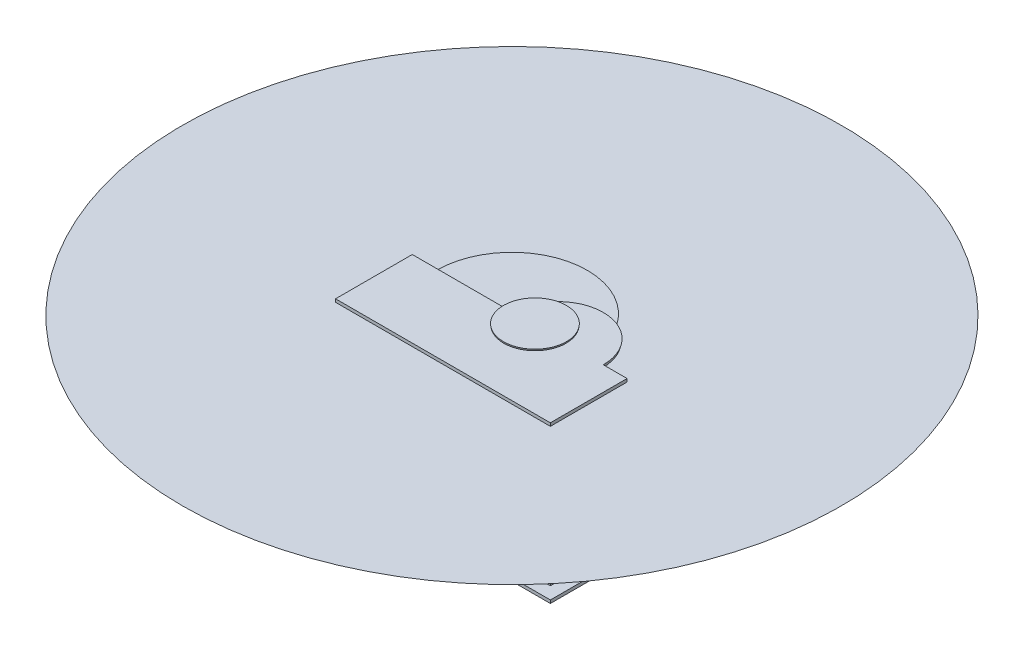
from build123d import *

# Parameters (mm, degrees)
SKETCH1_R           = 0.25
BOSS_EXTRUDE1_DEPTH = 10.1
BOSS_EXTRUDE1_DRAFT = -15
SKETCH2_R           = 0.25
BOSS_EXTRUDE2_DEPTH = 10
BOSS_EXTRUDE2_DRAFT = 25
SKETCH3_W           = 14
SKETCH3_H           = 0.2
EXTRUDE_THIN1_DEPTH = 5
SKETCH4_W           = 2.1
SKETCH4_H           = 2.1
BOSS_EXTRUDE3_DEPTH = 0.7
SKETCH5_W           = 2
SKETCH5_H           = 3.8
BOSS_EXTRUDE4_DEPTH = 2.1
SKETCH7_R           = 0.25
BOSS_EXTRUDE5_DEPTH = 9.9
BOSS_EXTRUDE5_DRAFT = -65
SKETCH8_W           = 0.8
SKETCH8_H           = 1.6
BOSS_EXTRUDE6_DEPTH = 0.8
SKETCH9_R           = 0.25
BOSS_EXTRUDE7_DEPTH = 10.2
BOSS_EXTRUDE7_DRAFT = -10


with BuildPart() as part:
    # Sketch1 → Boss-Extrude1 (with draft: the straight prism first)
    with BuildSketch(Plane(origin=(0, 0, 0), x_dir=(1, 0, 0), z_dir=(0, 1, 0))):
        Circle(SKETCH1_R)
    extrude(amount=BOSS_EXTRUDE1_DEPTH)
    # Boss-Extrude1: the draft: its side faces are tilted about the plane it starts from
    boss_extrude1_sides = [part.faces().sort_by_distance(p)[0] for p in [
        (-0.25, 5.05, 0),
    ]]
    draft(boss_extrude1_sides, Plane(origin=(0, 0, 0), x_dir=(1, 0, 0), z_dir=(0, 1, 0)), BOSS_EXTRUDE1_DRAFT)



with BuildPart() as body_2:
    # Sketch2 → Boss-Extrude2 (with draft: the straight prism first)
    with BuildSketch(Plane.XZ):
        with Locations((-3, 0)):
            Circle(SKETCH2_R)
    extrude(amount=-BOSS_EXTRUDE2_DEPTH)
    # Boss-Extrude2: the draft: its side faces are tilted about the plane it starts from
    boss_extrude2_sides = [body_2.faces().sort_by_distance(p)[0] for p in [
        (-3.25, 5, 0),
    ]]
    draft(boss_extrude2_sides, Plane.XZ, BOSS_EXTRUDE2_DRAFT)


with BuildPart() as part_1:
    add(part.part)

    add(body_2.part)  # Extrude-Thin1 merges body 2
    # Sketch3 → Extrude-Thin1 (add)
    with BuildSketch(Plane.XY):
        with Locations((-2.495263261, 0)):
            Rectangle(SKETCH3_W, SKETCH3_H)
        with Locations((-2.495263261, 1)):
            Rectangle(SKETCH3_W, SKETCH3_H)
        with Locations((-2.495263261, 2)):
            Rectangle(SKETCH3_W, SKETCH3_H)
        with Locations((-2.495263261, 3)):
            Rectangle(SKETCH3_W, SKETCH3_H)
        with Locations((-2.495263261, 4)):
            Rectangle(SKETCH3_W, SKETCH3_H)
        with Locations((-2.495263261, 5)):
            Rectangle(SKETCH3_W, SKETCH3_H)
        with Locations((-2.495263261, 6)):
            Rectangle(SKETCH3_W, SKETCH3_H)
        with Locations((-2.495263261, 7)):
            Rectangle(SKETCH3_W, SKETCH3_H)
        with Locations((-2.495263261, 8)):
            Rectangle(SKETCH3_W, SKETCH3_H)
        with Locations((-2.495263261, 9)):
            Rectangle(SKETCH3_W, SKETCH3_H)
        with Locations((-2.495263261, 10)):
            Rectangle(SKETCH3_W, SKETCH3_H)
    extrude(amount=EXTRUDE_THIN1_DEPTH)

    # Sketch4 → Boss-Extrude3 (add)
    with BuildSketch(Plane(origin=(0, 0, 0), x_dir=(1, 0, 0), z_dir=(0, 1, 0))):
        with Locations((-3, 0)):
            Rectangle(SKETCH4_W, SKETCH4_H)
    extrude(amount=-BOSS_EXTRUDE3_DEPTH)

    # Sketch5 → Boss-Extrude4 (add)
    with BuildSketch(Plane.XZ):
        Rectangle(SKETCH5_W, SKETCH5_H)
    extrude(amount=BOSS_EXTRUDE4_DEPTH)


with BuildPart() as boss_extrude5_tool:
    # Sketch7 → Boss-Extrude5 (with draft: the straight prism first)
    with BuildSketch(Plane(origin=(0, 0, 0), x_dir=(1, 0, 0), z_dir=(0, 1, 0))):
        with Locations((-3, 0)):
            Circle(SKETCH7_R)
    extrude(amount=BOSS_EXTRUDE5_DEPTH)
    # Boss-Extrude5: the draft: its side faces are tilted about the plane it starts from
    boss_extrude5_sides = [boss_extrude5_tool.faces().sort_by_distance(p)[0] for p in [
        (-3.25, 4.95, 0),
    ]]
    draft(boss_extrude5_sides, Plane(origin=(0, 0, 0), x_dir=(1, 0, 0), z_dir=(0, 1, 0)), BOSS_EXTRUDE5_DRAFT)


with BuildPart() as part_2:
    add(part_1.part)

    # Boss-Extrude5: add boss_extrude5_tool
    add(boss_extrude5_tool.part)

    # Sketch8 → Boss-Extrude6 (add)
    with BuildSketch(Plane.XZ):
        with Locations((-3, 0)):
            Rectangle(SKETCH8_W, SKETCH8_H)
    extrude(amount=BOSS_EXTRUDE6_DEPTH)


with BuildPart() as boss_extrude7_tool:
    # Sketch9 → Boss-Extrude7 (with draft: the straight prism first)
    with BuildSketch(Plane(origin=(0, 0, 0), x_dir=(1, 0, 0), z_dir=(0, 1, 0))):
        with Locations((-1.5, 0)):
            Circle(SKETCH9_R)
    extrude(amount=BOSS_EXTRUDE7_DEPTH)
    # Boss-Extrude7: the draft: its side faces are tilted about the plane it starts from
    boss_extrude7_sides = [boss_extrude7_tool.faces().sort_by_distance(p)[0] for p in [
        (-1.75, 5.1, 0),
    ]]
    draft(boss_extrude7_sides, Plane(origin=(0, 0, 0), x_dir=(1, 0, 0), z_dir=(0, 1, 0)), BOSS_EXTRUDE7_DRAFT)


with BuildPart() as part_3:
    add(part_2.part)

    # Boss-Extrude7: add boss_extrude7_tool
    add(boss_extrude7_tool.part)


solid = part_3.part
